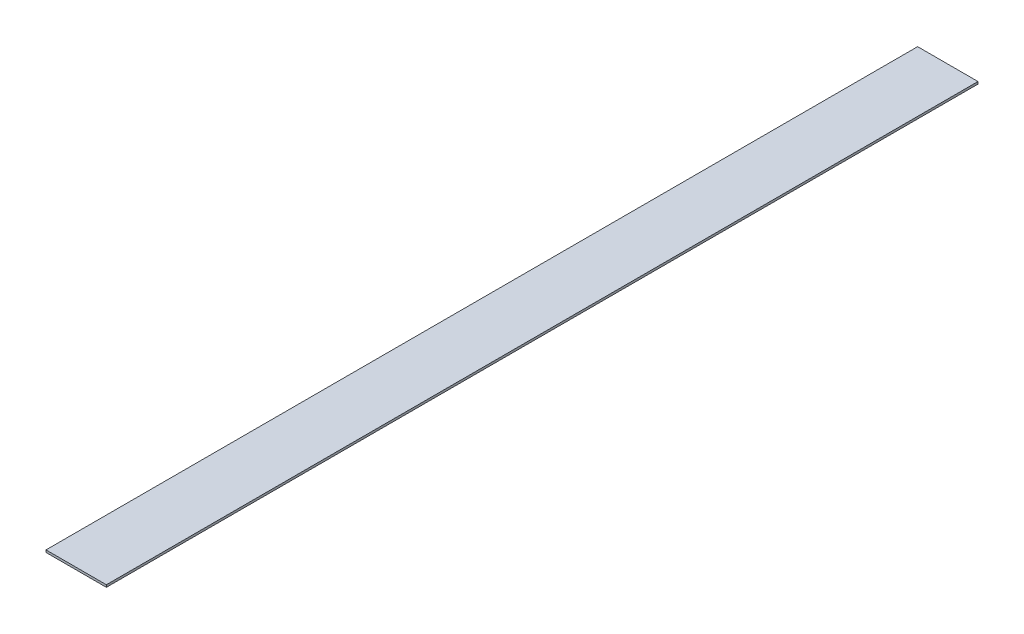
from build123d import *

# Parameters (mm, degrees)
ESQUISSE1_W        = 40
ESQUISSE1_H        = 1.5
BOSS_EXTRU_1_DEPTH = 577.5


with BuildPart() as part:
    # Esquisse1 → Boss.-Extru.1 (new body)
    with BuildSketch(Plane.XY):
        with Locations((20, 0.75)):
            Rectangle(ESQUISSE1_W, ESQUISSE1_H)
    extrude(amount=BOSS_EXTRU_1_DEPTH)


solid = part.part
